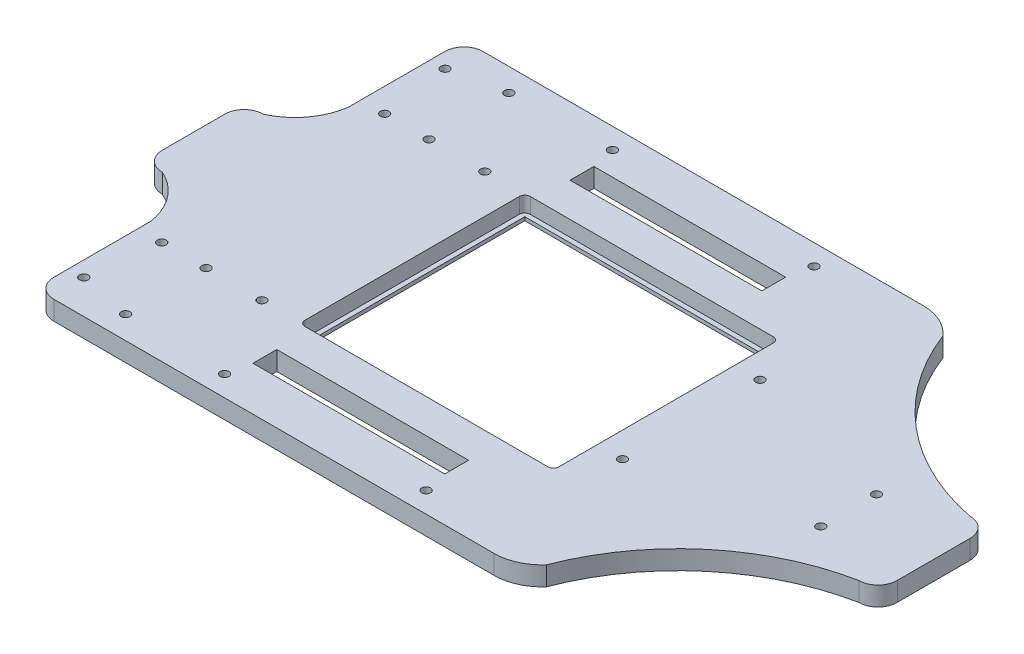
from build123d import *

# Parameters (mm, degrees)
SALIENTE_EXTRUIR1_DEPTH = 8
CROQUIS2_R              = 1.825
CROQUIS2_W              = 80.45
CROQUIS2_H              = 10
CORTAR_EXTRUIR1_DEPTH   = 220.463870727
CROQUIS3_R              = 1.825
CORTAR_EXTRUIR2_DEPTH   = 220.463870727
CROQUIS4_W              = 106.5
CROQUIS4_H              = 94.5
CORTAR_EXTRUIR3_DEPTH   = 6.5
REDONDEO1_R             = 2.3
CROQUIS5_R              = 1.825
CORTAR_EXTRUIR4_DEPTH   = 220.463870727
CROQUIS6_W              = 102.5
CROQUIS6_H              = 90.5
CORTAR_EXTRUIR5_DEPTH   = 220.414312556
CROQUIS9_R              = 1.825
CORTAR_EXTRUIR7_DEPTH   = 220.463870727
CROQUIS11_R             = 1.825
CORTAR_EXTRUIR8_DEPTH   = 220.463870727


with BuildPart() as part:
    # Croquis1 → Saliente-Extruir1 (new body)
    with BuildSketch(Plane(origin=(0, 0, 0), x_dir=(1, 0, 0), z_dir=(0, 1, 0))):
        with BuildLine():
            Line((0, 0), (200, 0))
            Line((200, 0), (200, 15.2))
            ThreePointArc((200, 15.2), (197.701163079, 20.938172036), (191.9990235, 23.3249845))
            ThreePointArc((191.9990235, 23.3249845), (148.666739026, 44.032184001), (120.7781513, 83.1307986))
            ThreePointArc((120.7781513, 83.1307986), (113.982057966, 88.196272982), (105.7, 90))
            Line((105.7, 90), (0, 90))
            Line((0, 90), (-79, 90))
            ThreePointArc((-79, 90), (-84.638146896, 87.675499941), (-86.999825594, 82.052824894))
            Line((-86.999825594, 82.052824894), (-86.999825594, 41.494023494))
            ThreePointArc((-86.999825594, 41.494023494), (-92.052704294, 29.329564667), (-102.353503833, 21.119864881))
            ThreePointArc((-102.353503833, 21.119864881), (-108.040391417, 18.79326931), (-110.4, 13.12))
            Line((-110.4, 13.12), (-110.4, 0))
            Line((-110.4, 0), (0, 0))
        make_face()
    extrude(amount=SALIENTE_EXTRUIR1_DEPTH)

    # Simetría2: part across plane


with BuildPart() as part_1:
    add(part.part)
    add(part.part.mirror(Plane(origin=(0, 8, 0), x_dir=(1, 0, 0), z_dir=(0, 0, -1))))

    # Croquis2 → Cortar-Extruir1 (cut, through all)
    with BuildSketch(Plane(origin=(0, 8, 0), x_dir=(1, 0, 0), z_dir=(0, 1, 0))):
        with Locations(Location((68.5, 81.35, 0), (0, 0, 270))):
            Circle(CROQUIS2_R)
        with Locations(Location((-16.05, 81.35, 0), (0, 0, 270))):
            Circle(CROQUIS2_R)
        with Locations(Location((68.5, -81.35, 0), (0, 0, 90))):
            Circle(CROQUIS2_R)
        with Locations(Location((-16.05, -81.35, 0), (0, 0, 90))):
            Circle(CROQUIS2_R)
        with Locations((26.225, -66.5)):
            Rectangle(CROQUIS2_W, CROQUIS2_H)
        with Locations((26.225, 66.5)):
            Rectangle(CROQUIS2_W, CROQUIS2_H)
    extrude(amount=-CORTAR_EXTRUIR1_DEPTH, mode=Mode.SUBTRACT)

    # Croquis3 → Cortar-Extruir2 (cut, through all)
    with BuildSketch(Plane(origin=(0, 8, 0), x_dir=(1, 0, 0), z_dir=(0, 1, 0))):
        with Locations(Location((-76.999825594, -46.75, 0), (0, 0, 270))):
            Circle(CROQUIS3_R)
        with Locations(Location((-34.999825594, -46.75, 0), (0, 0, 270))):
            Circle(CROQUIS3_R)
        with Locations(Location((-34.999825594, 46.75, 0), (0, 0, 90))):
            Circle(CROQUIS3_R)
        with Locations(Location((-76.999825594, 46.75, 0), (0, 0, 90))):
            Circle(CROQUIS3_R)
    extrude(amount=-CORTAR_EXTRUIR2_DEPTH, mode=Mode.SUBTRACT)

    # Croquis4 → Cortar-Extruir3 (cut)
    with BuildSketch(Plane(origin=(0, 8, 0), x_dir=(1, 0, 0), z_dir=(0, 1, 0))):
        with Locations((34.525174406, 0)):
            Rectangle(CROQUIS4_W, CROQUIS4_H)
    extrude(amount=-CORTAR_EXTRUIR3_DEPTH, mode=Mode.SUBTRACT)

    # Redondeo1
    redondeo1_edges = [part_1.edges().sort_by_distance(p)[0] for p in [
        (87.775174406, 4.75, -47.25),
        (87.775174406, 4.75, 47.25),
        (-18.724825594, 4.75, 47.25),
        (-18.724825594, 4.75, -47.25),
    ]]
    fillet(redondeo1_edges, radius=REDONDEO1_R)

    # Croquis5 → Cortar-Extruir4 (cut, through all)
    with BuildSketch(Plane(origin=(0, 8, 0), x_dir=(1, 0, 0), z_dir=(0, 1, 0))):
        with Locations(Location((98.35, 28.84, 0), (0, 0, 270))):
            Circle(CROQUIS5_R)
        with Locations(Location((98.35, -28.84, 0), (0, 0, 90))):
            Circle(CROQUIS5_R)
        with Locations(Location((164.35, 11.66, 0), (0, 0, 270))):
            Circle(CROQUIS5_R)
        with Locations(Location((164.35, -11.66, 0), (0, 0, 90))):
            Circle(CROQUIS5_R)
    extrude(amount=-CORTAR_EXTRUIR4_DEPTH, mode=Mode.SUBTRACT)

    # Croquis6 → Cortar-Extruir5 (cut, through all)
    with BuildSketch(Plane(origin=(0, 1.5, 0), x_dir=(1, 0, 0), z_dir=(0, 1, 0))):
        with Locations((34.525174406, 0)):
            Rectangle(CROQUIS6_W, CROQUIS6_H)
    extrude(amount=-CORTAR_EXTRUIR5_DEPTH, mode=Mode.SUBTRACT)

    # Croquis9 → Cortar-Extruir7 (cut, through all)
    with BuildSketch(Plane(origin=(0, 8, 0), x_dir=(1, 0, 0), z_dir=(0, 1, 0))):
        with Locations(Location((-80.675393895, -75.767215538, 0), (0, 0, 270))):
            Circle(CROQUIS9_R)
        with Locations(Location((-58.52366486, -80.370640978, 0), (0, 0, 270))):
            Circle(CROQUIS9_R)
        with Locations(Location((-58.52366486, 80.370640978, 0), (0, 0, 90))):
            Circle(CROQUIS9_R)
        with Locations(Location((-80.675393895, 75.767215538, 0), (0, 0, 90))):
            Circle(CROQUIS9_R)
    extrude(amount=-CORTAR_EXTRUIR7_DEPTH, mode=Mode.SUBTRACT)

    # Croquis11 → Cortar-Extruir8 (cut, through all)
    with BuildSketch(Plane(origin=(0, 8, 0), x_dir=(1, 0, 0), z_dir=(0, 1, 0))):
        with Locations(Location((-58.4, 46.75, 0), (0, 0, 270))):
            Circle(CROQUIS11_R)
        with Locations(Location((-58.4, -46.75, 0), (0, 0, 90))):
            Circle(CROQUIS11_R)
    extrude(amount=-CORTAR_EXTRUIR8_DEPTH, mode=Mode.SUBTRACT)


solid = part_1.part
